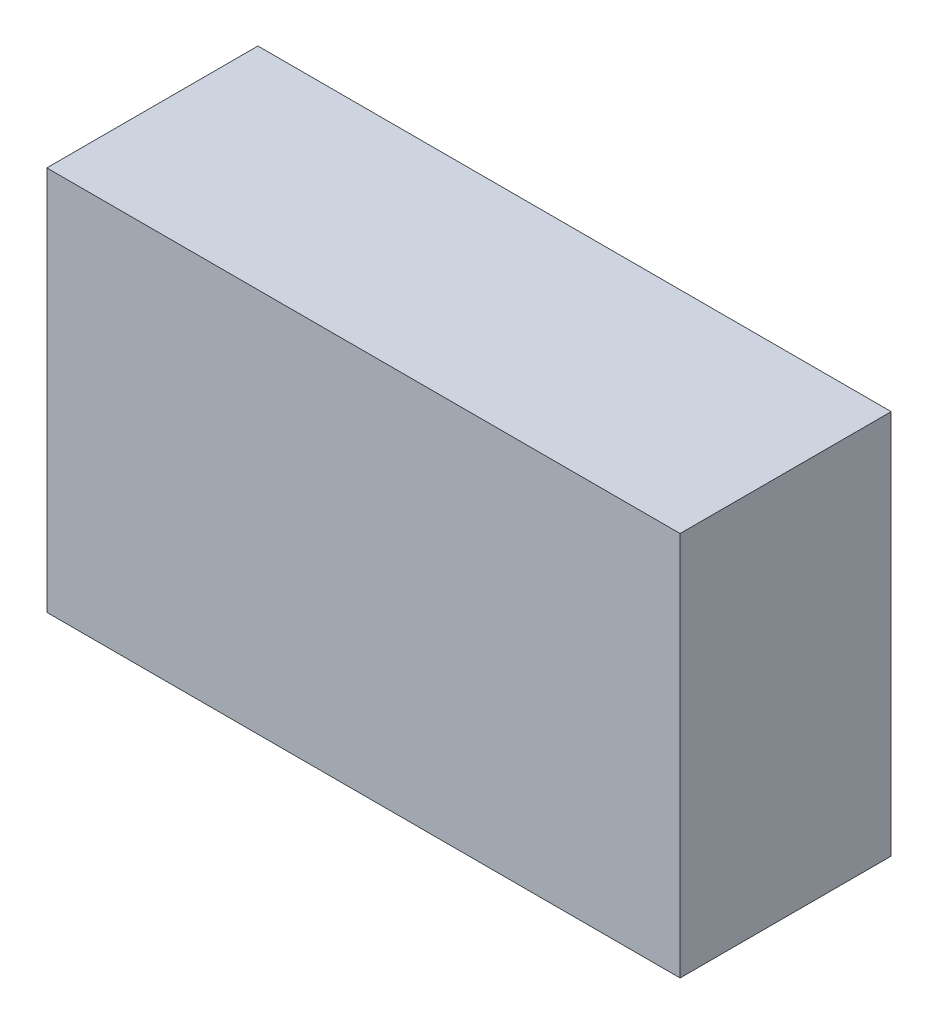
from build123d import *

# Parameters (mm, degrees)
SKETCH1_W           = 51
SKETCH1_H           = 31
BOSS_EXTRUDE1_DEPTH = 17


with BuildPart() as part:
    # Sketch1 → Boss-Extrude1 (new body)
    with BuildSketch(Plane.XY):
        Rectangle(SKETCH1_W, SKETCH1_H)
    extrude(amount=BOSS_EXTRUDE1_DEPTH)


solid = part.part
